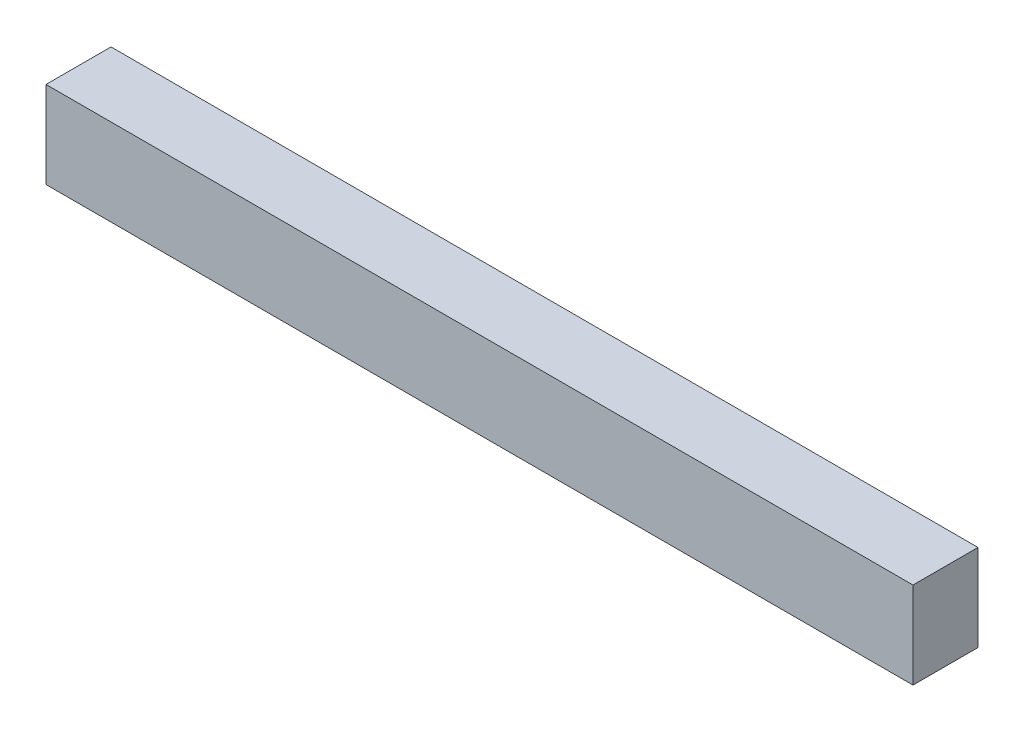
from build123d import *

# Parameters (mm, degrees)
ESQUISSE1_W        = 400
ESQUISSE1_H        = 40
BOSS_EXTRU_1_DEPTH = 30


with BuildPart() as part:
    # Esquisse1 → Boss.-Extru.1 (new body)
    with BuildSketch(Plane.XY):
        with Locations((200, -489.409867617)):
            Rectangle(ESQUISSE1_W, ESQUISSE1_H)
    extrude(amount=BOSS_EXTRU_1_DEPTH)


solid = part.part
